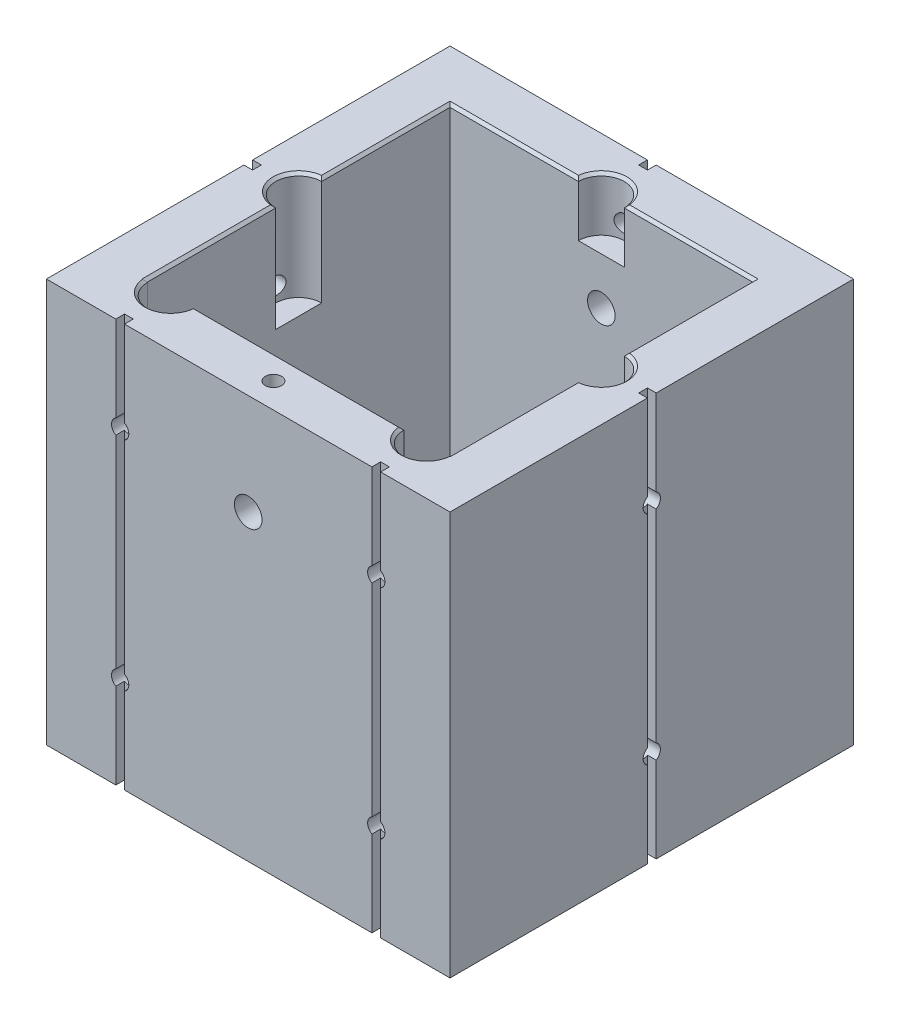
from build123d import *

# Parameters (mm, degrees)
SKETCH1_W           = 74.8
SKETCH1_H           = 74.8
SKETCH1_W_2         = 56.1
SKETCH1_H_2         = 56.1
BOSS_EXTRUDE1_DEPTH = 74.8
SKETCH2_R           = 2.555
CUT_EXTRUDE1_DEPTH  = 74.8
SKETCH3_W           = 1.62
SKETCH3_H           = 1.62
CUT_EXTRUDE2_DEPTH  = 74.8
CHAMFER1_SIZE       = 0.5
SKETCH4_W           = 1.62
SKETCH4_H           = 1.62
CUT_EXTRUDE3_DEPTH  = 74.8
CUT_EXTRUDE4_DEPTH  = 10
CUT_EXTRUDE5_DEPTH  = 20
CUT_EXTRUDE6_START  = -20
CUT_EXTRUDE6_DEPTH  = 20
CHAMFER2_SIZE       = 0.5
SKETCH8_R           = 1.6
CUT_EXTRUDE7_DEPTH  = 80
SKETCH9_R           = 1.6
CUT_EXTRUDE8_DEPTH  = 10
SKETCH11_R          = 1.6
CUT_EXTRUDE9_DEPTH  = 10
SKETCH12_R          = 1.5
CUT_EXTRUDE10_DEPTH = 20


with BuildPart() as part:
    # Sketch1 → Boss-Extrude1 (new body)
    with BuildSketch(Plane(origin=(0, 0, 0), x_dir=(1, 0, 0), z_dir=(0, 1, 0))):
        with Locations((37.4, 37.4)):
            Rectangle(SKETCH1_W, SKETCH1_H)
        with Locations((37.4, 37.4)):
            Rectangle(SKETCH1_W_2, SKETCH1_H_2, mode=Mode.SUBTRACT)
    extrude(amount=BOSS_EXTRUDE1_DEPTH)

    # Sketch2 → Cut-Extrude1 (cut)
    with BuildSketch(Plane(origin=(0, 0, -74.8), x_dir=(-1, 0, 0), z_dir=(0, 0, -1))):
        with Locations((-37.4, 56.1)):
            Circle(SKETCH2_R)
    extrude(amount=-CUT_EXTRUDE1_DEPTH, mode=Mode.SUBTRACT)

    # Sketch3 → Cut-Extrude2 (cut)
    with BuildSketch(Plane(origin=(0, 74.8, 0), x_dir=(1, 0, 0), z_dir=(0, 1, 0))):
        with Locations((37.4, 73.99)):
            Rectangle(SKETCH3_W, SKETCH3_H)
    cut_extrude2 = extrude(amount=-CUT_EXTRUDE2_DEPTH, mode=Mode.SUBTRACT)

    # Mirror1: Cut-Extrude2 across plane
    add(cut_extrude2.mirror(Plane(origin=(0, 0, 0), x_dir=(-0.7071067811865477, 0, 0.7071067811865474), z_dir=(0.7071067811865476, 0, 0.7071067811865476))), mode=Mode.SUBTRACT)

    # Mirror2: Cut-Extrude2 across plane
    add(cut_extrude2.mirror(Plane(origin=(37.4, 0, -37.4), x_dir=(0.7071067811865475, 0, 0.7071067811865477), z_dir=(0.7071067811865476, 0, -0.7071067811865475))), mode=Mode.SUBTRACT)

    # Chamfer1
    chamfer1_edges = [part.edges().sort_by_distance(p)[0] for p in [
        (37.4, 74.8, -65.45),
        (65.45, 74.8, -37.4),
        (37.4, 74.8, -9.35),
        (9.35, 74.8, -37.4),
    ]]
    chamfer(chamfer1_edges, length=CHAMFER1_SIZE)

    # Sketch4 → Cut-Extrude3 (cut)
    with BuildSketch(Plane(origin=(0, 74.8, 0), x_dir=(1, 0, 0), z_dir=(0, 1, 0))):
        with Locations((61.135, 0.81)):
            Rectangle(SKETCH4_W, SKETCH4_H)
        with Locations((13.665, 0.81)):
            Rectangle(SKETCH4_W, SKETCH4_H)
    extrude(amount=-CUT_EXTRUDE3_DEPTH, mode=Mode.SUBTRACT)

    # Sketch5 → Cut-Extrude4 (cut)
    with BuildSketch(Plane(origin=(0, 74.8, 0), x_dir=(1, 0, 0), z_dir=(0, 1, 0))):
        with BuildLine():
            Line((33.15, 65.45), (41.65, 65.45))
            ThreePointArc((41.65, 65.45), (37.4, 69.7), (33.15, 65.45))
        make_face()
    extrude(amount=-CUT_EXTRUDE4_DEPTH, mode=Mode.SUBTRACT)

    # Sketch6 → Cut-Extrude5 (cut)
    with BuildSketch(Plane(origin=(0, 74.8, 0), x_dir=(1, 0, 0), z_dir=(0, 1, 0))):
        with BuildLine():
            Line((65.385, 9.35), (56.885, 9.35))
            ThreePointArc((56.885, 9.35), (61.135, 5.1), (65.385, 9.35))
        make_face()
        with BuildLine():
            Line((9.35, 33.15), (9.35, 41.65))
            ThreePointArc((9.35, 41.65), (5.1, 37.4), (9.35, 33.15))
        make_face()
        with BuildLine():
            Line((65.45, 41.65), (65.45, 33.15))
            ThreePointArc((65.45, 33.15), (69.7, 37.4), (65.45, 41.65))
        make_face()
        with BuildLine():
            Line((17.915, 9.35), (9.415, 9.35))
            ThreePointArc((9.415, 9.35), (13.665, 5.1), (17.915, 9.35))
        make_face()
    extrude(amount=-CUT_EXTRUDE5_DEPTH, mode=Mode.SUBTRACT)

    # Sketch7 → Cut-Extrude6 (cut)
    with BuildSketch(Plane(origin=(0, 0, 0), x_dir=(-1, 0, 0), z_dir=(0, -1, 0)).offset(CUT_EXTRUDE6_START)):
        with BuildLine():
            Line((-9.35, 41.65), (-9.35, 33.15))
            ThreePointArc((-9.35, 33.15), (-5.1, 37.4), (-9.35, 41.65))
        make_face()
        with BuildLine():
            ThreePointArc((-17.915, 9.35), (-13.665, 5.1), (-9.415, 9.35))
            Line((-9.415, 9.35), (-17.915, 9.35))
        make_face()
        with BuildLine():
            Line((-41.65, 65.45), (-33.15, 65.45))
            ThreePointArc((-33.15, 65.45), (-37.4, 69.7), (-41.65, 65.45))
        make_face()
        with BuildLine():
            ThreePointArc((-65.385, 9.35), (-61.135, 5.1), (-56.885, 9.35))
            Line((-56.885, 9.35), (-65.385, 9.35))
        make_face()
        with BuildLine():
            Line((-65.45, 33.15), (-65.45, 41.65))
            ThreePointArc((-65.45, 41.65), (-69.7, 37.4), (-65.45, 33.15))
        make_face()
    extrude(amount=CUT_EXTRUDE6_DEPTH, mode=Mode.SUBTRACT)

    # Chamfer2
    chamfer2_edges = [part.edges().sort_by_distance(p)[0] for p in [
        (37.4, 74.8, -69.7),
        (5.1, 74.8, -37.4),
        (13.665, 74.8, -5.1),
        (69.7, 74.8, -37.4),
        (61.135, 74.8, -5.1),
    ]]
    chamfer(chamfer2_edges, length=CHAMFER2_SIZE)

    # Sketch8 → Cut-Extrude7 (cut)
    with BuildSketch(Plane(origin=(74.8, 0, 0), x_dir=(0, 0, -1), z_dir=(1, 0, 0))):
        with Locations((37.4, 17.25)):
            Circle(SKETCH8_R)
        with Locations((37.4, 57.55)):
            Circle(SKETCH8_R)
    extrude(amount=-CUT_EXTRUDE7_DEPTH, mode=Mode.SUBTRACT)

    # Sketch9 → Cut-Extrude8 (cut)
    with BuildSketch(Plane.XY):
        with Locations((61.135, 17.25)):
            Circle(SKETCH9_R)
        with Locations((13.665, 17.25)):
            Circle(SKETCH9_R)
        with Locations((61.135, 57.55)):
            Circle(SKETCH9_R)
        with Locations((13.665, 57.55)):
            Circle(SKETCH9_R)
    extrude(amount=-CUT_EXTRUDE8_DEPTH, mode=Mode.SUBTRACT)

    # Sketch11 → Cut-Extrude9 (cut)
    with BuildSketch(Plane(origin=(0, 0, -73.18), x_dir=(-1, 0, 0), z_dir=(0, 0, -1))):
        with Locations((-37.4, 17.25)):
            Circle(SKETCH11_R)
        with Locations((-37.4, 67.55)):
            Circle(SKETCH11_R)
    extrude(amount=-CUT_EXTRUDE9_DEPTH, mode=Mode.SUBTRACT)

    # Sketch12 → Cut-Extrude10 (cut)
    with BuildSketch(Plane(origin=(0, 74.8, 0), x_dir=(1, 0, 0), z_dir=(0, 1, 0))):
        with Locations((37.4, 4.675)):
            Circle(SKETCH12_R)
    extrude(amount=-CUT_EXTRUDE10_DEPTH, mode=Mode.SUBTRACT)


solid = part.part
